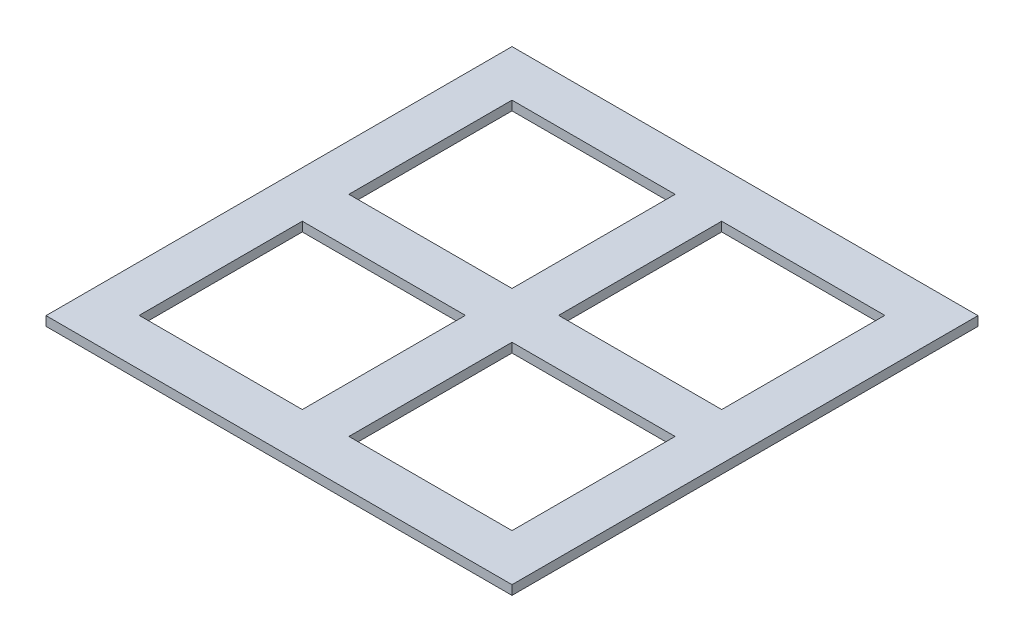
from build123d import *

# Parameters (mm, degrees)
SKETCH1_W           = 100
SKETCH1_H           = 100
SKETCH1_W_2         = 35
SKETCH1_H_2         = 35
BOSS_EXTRUDE1_DEPTH = 2


with BuildPart() as part:
    # Sketch1 → Boss-Extrude1 (new body)
    with BuildSketch(Plane(origin=(0, 0, 0), x_dir=(1, 0, 0), z_dir=(0, 1, 0))):
        with Locations((50, 50)):
            Rectangle(SKETCH1_W, SKETCH1_H)
        with Locations((72.453133131, 27.546866869)):
            Rectangle(SKETCH1_W_2, SKETCH1_H_2, mode=Mode.SUBTRACT)
        with Locations((27.453133131, 27.546866869)):
            Rectangle(SKETCH1_W_2, SKETCH1_H_2, mode=Mode.SUBTRACT)
        with Locations((72.453133131, 72.546866869)):
            Rectangle(SKETCH1_W_2, SKETCH1_H_2, mode=Mode.SUBTRACT)
        with Locations((27.453133131, 72.546866869)):
            Rectangle(SKETCH1_W_2, SKETCH1_H_2, mode=Mode.SUBTRACT)
    extrude(amount=BOSS_EXTRUDE1_DEPTH)


solid = part.part
